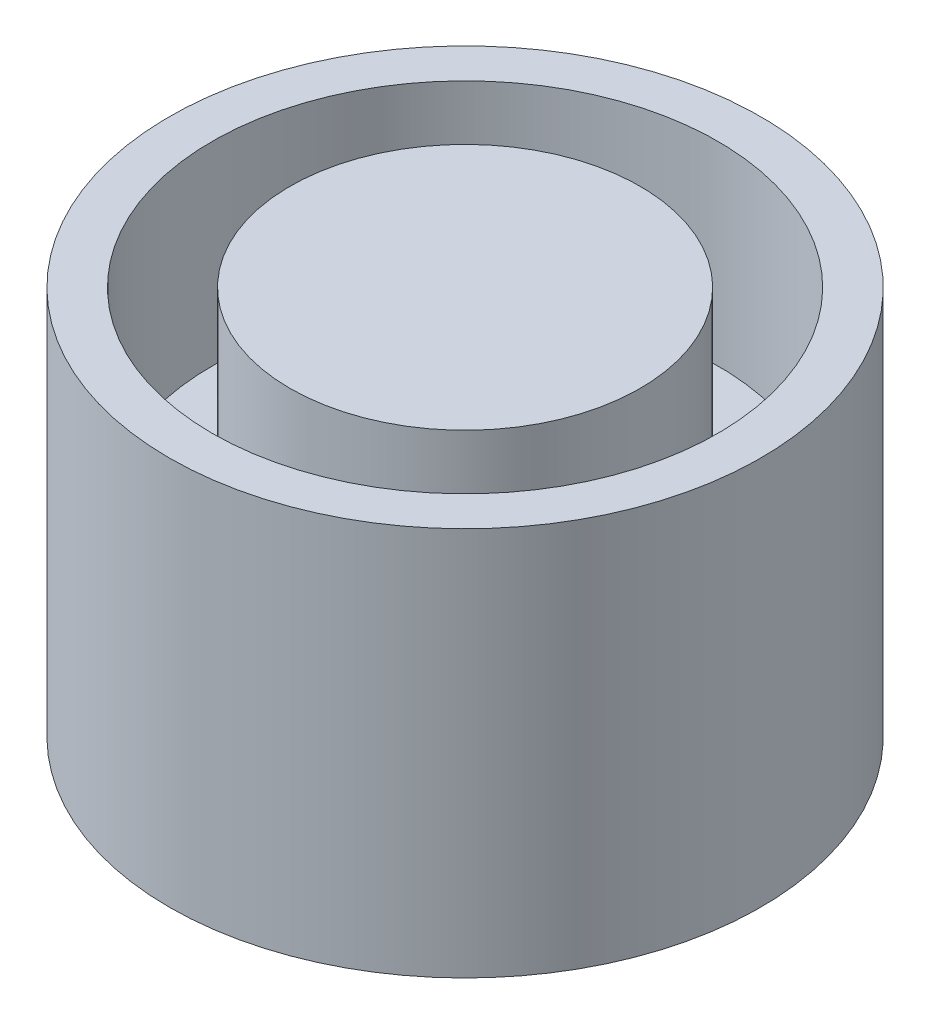
from build123d import *

# Parameters (mm, degrees)
SKETCH_1_R          = 7.6
EXTRUDE_1_DEPTH     = 10
SKETCH_5_R          = 6.5
SKETCH_5_R_2        = 4.5
CUT_EXTRUDE_1_DEPTH = 5


with BuildPart() as part:
    # 草图1 → 凸台-拉伸1 (new body)
    with BuildSketch(Plane(origin=(0, 0, 0), x_dir=(1, 0, 0), z_dir=(0, 1, 0))):
        with Locations(Location((0, 0, 0), (0, 0, 270))):
            Circle(SKETCH_1_R)
    extrude(amount=EXTRUDE_1_DEPTH)

    # 草图5 → 切除-拉伸1 (cut)
    with BuildSketch(Plane(origin=(0, 10, 0), x_dir=(1, 0, 0), z_dir=(0, 1, 0))):
        with Locations(Location((0, 0, 0), (0, 0, 270))):
            Circle(SKETCH_5_R)
        with Locations(Location((0, 0, 0), (0, 0, 270))):
            Circle(SKETCH_5_R_2, mode=Mode.SUBTRACT)
    extrude(amount=-CUT_EXTRUDE_1_DEPTH, mode=Mode.SUBTRACT)


solid = part.part
